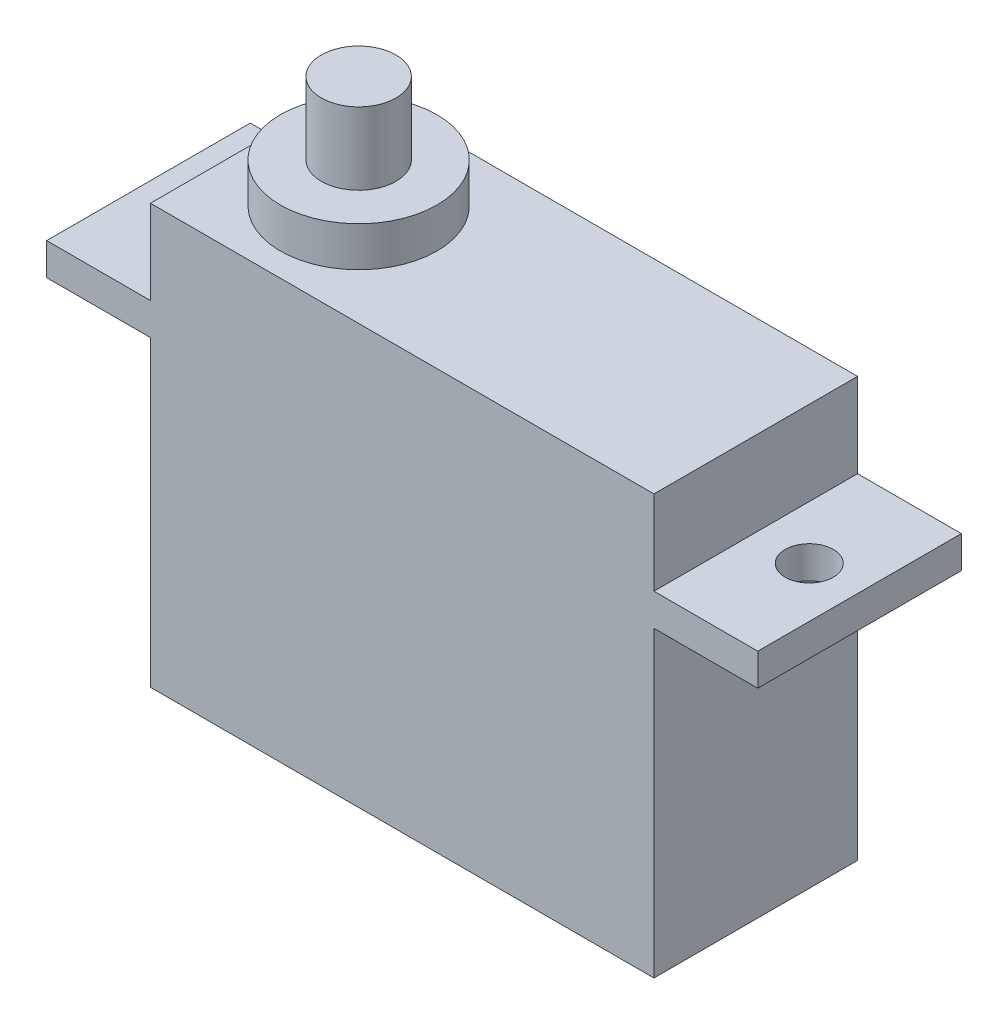
from build123d import *

# Parameters (mm, degrees)
BOSS_EXTRUDE1_DEPTH = 7.61
SKETCH2_R           = 0.9
CUT_EXTRUDE1_DEPTH  = 1.2
SKETCH3_R           = 2.926040877
BOSS_EXTRUDE2_DEPTH = 1.49
SKETCH4_R           = 1.393854302
BOSS_EXTRUDE3_DEPTH = 2.7


with BuildPart() as part:
    # Sketch1 → Boss-Extrude1 (new body)
    with BuildSketch(Plane.XY):
        Polygon((0, 0), (0, -11.32), (18.82, -11.32), (18.82, 0), (22.7, 0), (22.7, 1.2), (18.82, 1.2), (18.82, 4.35), (0, 4.35), (0, 1.2), (-3.88, 1.2), (-3.88, 0), align=None)
    extrude(amount=BOSS_EXTRUDE1_DEPTH)

    # Sketch2 → Cut-Extrude1 (cut)
    with BuildSketch(Plane(origin=(0, 1.2, 0), x_dir=(1, 0, 0), z_dir=(0, 1, 0))):
        with Locations(Location((20.82, -3.805, 0), (0, 0, 180))):
            Circle(SKETCH2_R)
        with Locations(Location((-2, -3.805, 0), (0, 0, 180))):
            Circle(SKETCH2_R)
    extrude(amount=-CUT_EXTRUDE1_DEPTH, mode=Mode.SUBTRACT)

    # Sketch3 → Boss-Extrude2 (add)
    with BuildSketch(Plane(origin=(0, 4.35, 0), x_dir=(1, 0, 0), z_dir=(0, 1, 0))):
        with Locations((3.977412239, -3.805)):
            Circle(SKETCH3_R)
    extrude(amount=BOSS_EXTRUDE2_DEPTH)

    # Sketch4 → Boss-Extrude3 (add)
    with BuildSketch(Plane(origin=(0, 5.84, 0), x_dir=(1, 0, 0), z_dir=(0, 1, 0))):
        with Locations((3.977412239, -3.805)):
            Circle(SKETCH4_R)
    extrude(amount=BOSS_EXTRUDE3_DEPTH)


solid = part.part
